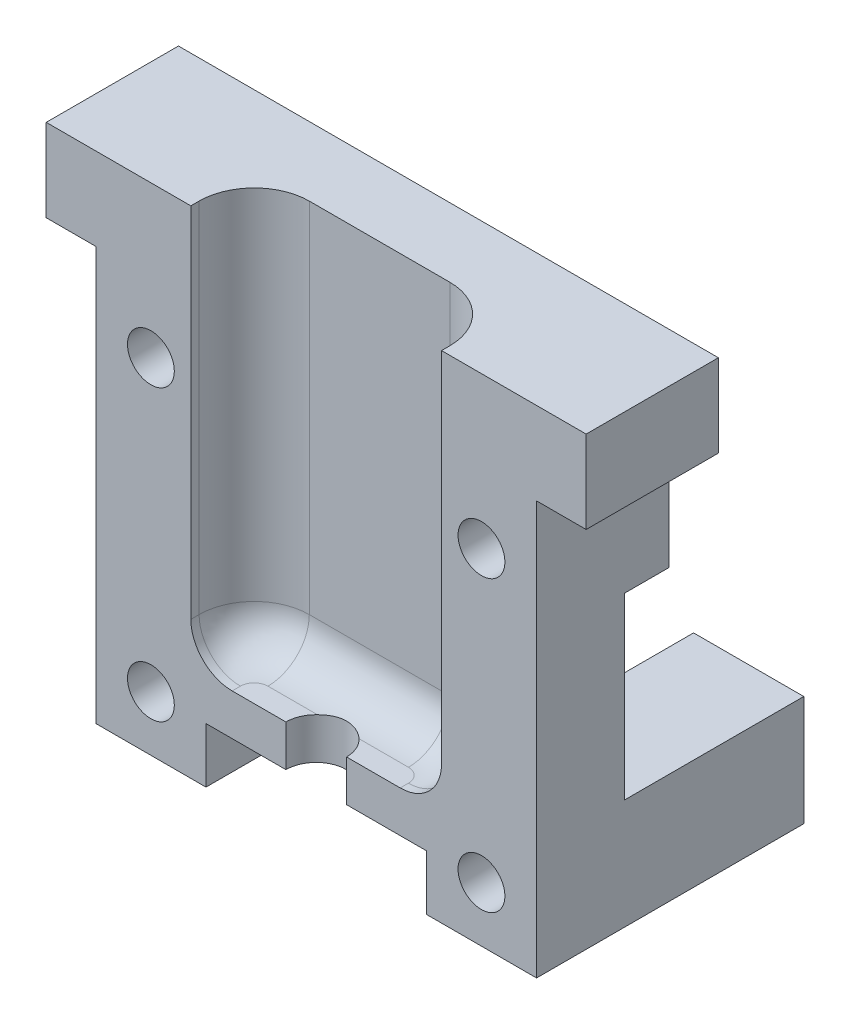
from build123d import *

# Parameters (mm, degrees)
EXTRUDE_1_DEPTH          = 16
CUT_EXTRUDE_1_DEPTH      = 29
FILLET_1_R               = 3
CUT_EXTRUDE_2_DEPTH      = 10
CUT_EXTRUDE_2_DEPTH_BACK = 16
SKETCH_3_R               = 1.7
SKETCH_4_R               = 2.2
CUT_EXTRUDE_3_DEPTH      = 3.0606
CUT_EXTRUDE_4_DEPTH      = 3
EXTRUDE_START            = 13
SKETCH_6_W               = 8
SKETCH_6_H               = 8
SKETCH_6_R               = 1.7
EXTRUDE_2_DEPTH          = 13
SKETCH_8_W               = 39.2
SKETCH_8_H               = 19.2
EXTRUDE_3_DEPTH          = 6
SKETCH_9_W               = 52.66631539
SKETCH_9_H               = 26.451368725
CUT_EXTRUDE_5_DEPTH      = 45.001818144
SKETCH_10_W              = 8
SKETCH_10_H              = 9
EXTRUDE_4_DEPTH          = 3.2
CUT_EXTRUDE_START        = -9.6
SKETCH_11_R              = 1.7
CUT_EXTRUDE_6_DEPTH      = 9.6
CUT_EXTRUDE_7_DEPTH      = 2.5


with BuildPart() as part:
    # Эскиз1 → Бобышка-Вытянуть1 (new body)
    with BuildSketch(Plane.XY):
        Polygon((8, -16), (-8, -16), (-8, -20), (-16, -20), (-16, -16), (-16, 16), (16, 16), (16, -16), (16, -20), (8, -20), align=None)
    extrude(amount=EXTRUDE_1_DEPTH)

    # Эскиз2 → Вырез-Вытянуть1 (cut)
    with BuildSketch(Plane(origin=(0, 16, 0), x_dir=(1, 0, 0), z_dir=(0, 1, 0))):
        with BuildLine():
            Line((5.1, -11), (-5.1, -11))
            ThreePointArc((-5.1, -11), (-7.928427125, -9.828427125), (-9.1, -7))
            Line((-9.1, -7), (-9.1, -5.8))
            ThreePointArc((-9.1, -5.8), (-7.928427125, -2.971572875), (-5.1, -1.8))
            Line((-5.1, -1.8), (5.1, -1.8))
            ThreePointArc((5.1, -1.8), (7.928427125, -2.971572875), (9.1, -5.8))
            Line((9.1, -5.8), (9.1, -7))
            ThreePointArc((9.1, -7), (7.928427125, -9.828427125), (5.1, -11))
        make_face()
    extrude(amount=-CUT_EXTRUDE_1_DEPTH, mode=Mode.SUBTRACT)

    # Скругление1
    fillet_1_edges = [part.edges().sort_by_distance(p)[0] for p in [
        (7.928427125, -13, 2.971572875),
        (9.1, -13, 6.4),
        (7.928427125, -13, 9.828427125),
        (0, -13, 11),
        (-7.928427125, -13, 9.828427125),
        (-9.1, -13, 6.4),
        (-7.928427125, -13, 2.971572875),
        (0, -13, 1.8),
    ]]
    fillet(fillet_1_edges, radius=FILLET_1_R)

    # Эскиз3 → Вырез-Вытянуть2 (cut, two sides: drawn at the far end of the back side and taken through both)
    with BuildSketch(Plane(origin=(0, 0, 0), x_dir=(-1, 0, 0), z_dir=(0, 0, -1)).offset(-CUT_EXTRUDE_2_DEPTH_BACK)):
        with Locations(Location((-12, -16, 0), (0, 0, 180))):
            Circle(SKETCH_3_R)
        with Locations(Location((-12, 5, 0), (0, 0, 180))):
            Circle(SKETCH_3_R)
        with Locations(Location((12, 5, 0), (0, 0, 180))):
            Circle(SKETCH_3_R)
        with Locations(Location((12, -16, 0), (0, 0, 180))):
            Circle(SKETCH_3_R)
    extrude(amount=CUT_EXTRUDE_2_DEPTH + CUT_EXTRUDE_2_DEPTH_BACK, mode=Mode.SUBTRACT)

    # Эскиз4 → Вырез-Вытянуть3 (cut)
    with BuildSketch(Plane(origin=(0, -16, 0), x_dir=(1, 0, 0), z_dir=(0, 1, 0))):
        with Locations(Location((0, -6.4, 0), (0, 0, 133.341758227))):
            Circle(SKETCH_4_R)
    extrude(amount=CUT_EXTRUDE_3_DEPTH, mode=Mode.SUBTRACT)

    # Эскиз5 → Вырез-Вытянуть4 (cut)
    with BuildSketch(Plane.XY.offset(16)):
        Polygon((-12, -12.709103466), (-14.85, -14.354551733), (-14.85, -17.645448267), (-12, -19.290896534), (-9.15, -17.645448267), (-9.15, -14.354551733), align=None)
        Polygon((9.15, -14.354551733), (12, -12.709103466), (14.85, -14.354551733), (14.85, -17.645448267), (12, -19.290896534), (9.15, -17.645448267), align=None)
    extrude(amount=-CUT_EXTRUDE_4_DEPTH, mode=Mode.SUBTRACT)

    # Эскиз6 → Бобышка-Вытянуть2 (add)
    # profile 1 of 2: a face of its own
    with BuildSketch(Plane(origin=(0, 0, 0), x_dir=(-1, 0, 0), z_dir=(0, 0, -1)).offset(EXTRUDE_START)):
        with Locations((-12, -16)):
            Rectangle(SKETCH_6_W, SKETCH_6_H)
        with Locations((-12, -16)):
            Circle(SKETCH_6_R, mode=Mode.SUBTRACT)
    # profile 2 of 2: a face of its own
    with BuildSketch(Plane(origin=(0, 0, 0), x_dir=(-1, 0, 0), z_dir=(0, 0, -1)).offset(EXTRUDE_START)):
        with Locations((12, -16)):
            Rectangle(SKETCH_6_W, SKETCH_6_H)
        with Locations(Location((12, -16, 0), (0, 0, 180))):
            Circle(SKETCH_6_R, mode=Mode.SUBTRACT)
    extrude(amount=-EXTRUDE_2_DEPTH)

    # Эскиз8 → Бобышка-Вытянуть3 (add)
    with BuildSketch(Plane(origin=(0, 16, 0), x_dir=(1, 0, 0), z_dir=(0, 1, 0))):
        with Locations((0, -6.4)):
            Rectangle(SKETCH_8_W, SKETCH_8_H)
        with BuildLine():
            Line((-9.1, -5.8), (-9.1, -7))
            ThreePointArc((-9.1, -7), (-7.928427125, -9.828427125), (-5.1, -11))
            Line((-5.1, -11), (5.1, -11))
            ThreePointArc((5.1, -11), (7.928427125, -9.828427125), (9.1, -7))
            Line((9.1, -7), (9.1, -5.8))
            ThreePointArc((9.1, -5.8), (7.928427125, -2.971572875), (5.1, -1.8))
            Line((5.1, -1.8), (-5.1, -1.8))
            ThreePointArc((-5.1, -1.8), (-7.928427125, -2.971572875), (-9.1, -5.8))
        make_face(mode=Mode.SUBTRACT)
    extrude(amount=-EXTRUDE_3_DEPTH)

    # Эскиз9 → Вырез-Вытянуть5 (cut, through all)
    with BuildSketch(Plane(origin=(0, 16, 0), x_dir=(1, 0, 0), z_dir=(0, 1, 0))):
        with Locations((6.733157695, -19.625684362)):
            Rectangle(SKETCH_9_W, SKETCH_9_H)
    extrude(amount=-CUT_EXTRUDE_5_DEPTH, mode=Mode.SUBTRACT)

    # Эскиз10 → Бобышка-Вытянуть4 (add)
    with BuildSketch(Plane(origin=(0, 0, 0), x_dir=(-1, 0, 0), z_dir=(0, 0, -1))):
        with Locations((12, 5.5)):
            Rectangle(SKETCH_10_W, SKETCH_10_H)
        with Locations((-12, 5.5)):
            Rectangle(SKETCH_10_W, SKETCH_10_H)
    extrude(amount=EXTRUDE_4_DEPTH)

    # Эскиз11 → Вырез-Вытянуть6 (cut)
    with BuildSketch(Plane.XY.offset(6.4).offset(CUT_EXTRUDE_START)):
        with Locations(Location((-12, 5, 0), (0, 0, 180))):
            Circle(SKETCH_11_R)
        with Locations(Location((12, 5, 0), (0, 0, 180))):
            Circle(SKETCH_11_R)
    extrude(amount=CUT_EXTRUDE_6_DEPTH, mode=Mode.SUBTRACT)

    # Эскиз12 → Вырез-Вытянуть7 (cut)
    with BuildSketch(Plane(origin=(0, 0, -3.2), x_dir=(-1, 0, 0), z_dir=(0, 0, -1))):
        Polygon((-12, 8.290896534), (-14.85, 6.645448267), (-14.85, 3.354551733), (-12, 1.709103466), (-9.15, 3.354551733), (-9.15, 6.645448267), align=None)
        Polygon((9.15, 6.645448267), (12, 8.290896534), (14.85, 6.645448267), (14.85, 3.354551733), (12, 1.709103466), (9.15, 3.354551733), align=None)
    extrude(amount=-CUT_EXTRUDE_7_DEPTH, mode=Mode.SUBTRACT)


solid = part.part
